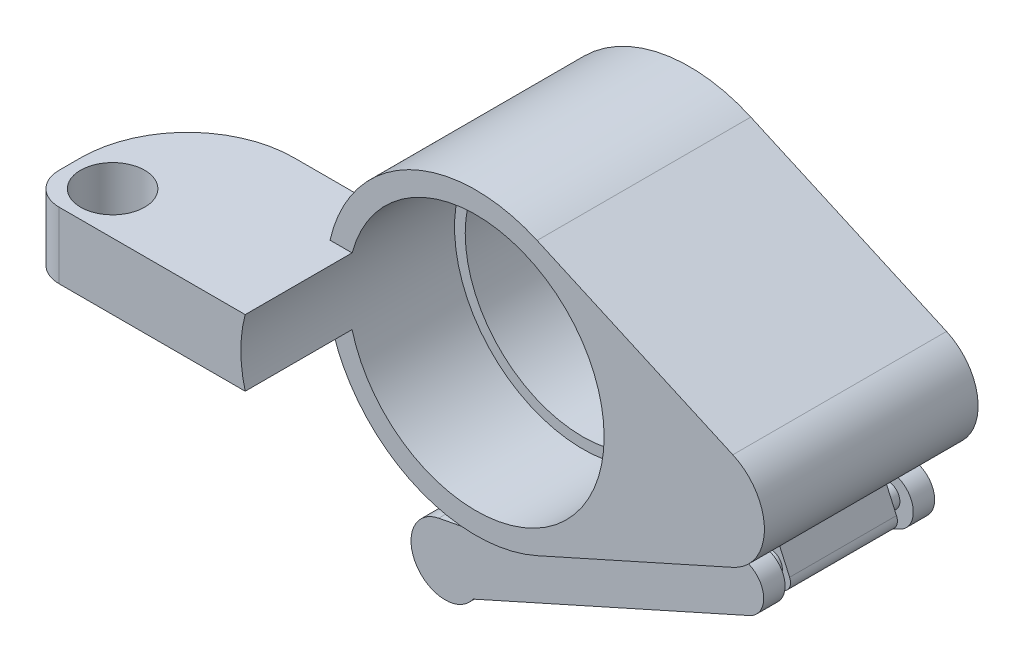
from build123d import *
from build123d.topology import SkipClean

# Parameters (mm, degrees)
ESQUISSE2_R             = 11
BOSS_EXTRU_1_DEPTH      = 20
ENL_V_START             = -10
ESQUISSE3_R             = 12
ESQUISSE3_R_2           = 11
ENL_V_MAT_EXTRU_1_DEPTH = 10
ESQUISSE4_W             = 3
ESQUISSE4_H             = 10
BOSS_EXTRU_2_DEPTH      = 4
ESQUISSE5_R             = 1.1
BOSS_EXTRU_3_DEPTH      = 1
ESQUISSE9_R             = 1.1
BOSS_EXTRU_5_DEPTH      = 2
BOSS_EXTRU_6_START      = -6
BOSS_EXTRU_6_DEPTH      = 8
CONG_1_R                = 1
CONG_2_R                = 1
BOSS_EXTRU_7_DEPTH      = 10
BOSS_EXTRU_8_DEPTH      = 10
BOSS_EXTRU_8_DEPTH_BACK = 5
CONG_3_R                = 10
CONG_4_R                = 3
ENL_V_MAT_EXTRU_2_REACH = 52.872
ESQUISSE11_R            = 3


with BuildPart() as part:
    # Esquisse2 → Boss.-Extru.1 (new body)
    with BuildSketch(Plane.XY):
        with BuildLine():
            Line((5.727272727, 12.774910845), (24.045454545, 4.562468159))
            ThreePointArc((24.045454545, 4.562468159), (27, 0), (24.045454545, -4.562468159))
            Line((24.045454545, -4.562468159), (5.727272727, -12.774910845))
            ThreePointArc((5.727272727, -12.774910845), (-14, 0), (5.727272727, 12.774910845))
        make_face()
        Circle(ESQUISSE2_R, mode=Mode.SUBTRACT)
    extrude(amount=BOSS_EXTRU_1_DEPTH)

    # Esquisse3 → Enlèv. mat.-Extru.1 (cut)
    with BuildSketch(Plane.XY.offset(20).offset(ENL_V_START)):
        Circle(ESQUISSE3_R)
        Circle(ESQUISSE3_R_2, mode=Mode.SUBTRACT)
    extrude(amount=ENL_V_MAT_EXTRU_1_DEPTH, mode=Mode.SUBTRACT)

    # Esquisse4 → Boss.-Extru.2 (add)
    with BuildSketch(Plane(origin=(5.727272727, -12.774910845, 0), x_dir=(0.9124936318129423, 0.4090909090909094, 0), z_dir=(0.40909090909090934, -0.9124936318129422, 0))):
        with Locations((17.5748599, 10)):
            Rectangle(ESQUISSE4_W, ESQUISSE4_H)
    extrude(amount=BOSS_EXTRU_2_DEPTH)

    # Esquisse5 → Boss.-Extru.3 (add)
    with BuildSketch(Plane.XY.offset(15)):
        with Locations(Location((22.582402284, -7.410182695, 0), (0, 0, 180))):
            Circle(ESQUISSE5_R)
    boss_extru_3 = extrude(amount=BOSS_EXTRU_3_DEPTH)

    # Symétrie1: Boss.-Extru.3 across plane
    add(boss_extru_3.mirror(Plane.XY.offset(10)))

    # Esquisse9 → Boss.-Extru.5 (add)
    # profile 1 of 2: a face of its own
    with BuildSketch(Plane.XY.offset(16)):
        with BuildLine():
            Line((21.323895477, -10.714144048), (23.605129557, -9.691416775))
            ThreePointArc((23.605129557, -9.691416775), (24.737785683, -6.717851558), (21.764220466, -5.585195432))
            Line((21.764220466, -5.585195432), (19.482986386, -6.607922705))
            Line((19.482986386, -6.607922705), (21.323895477, -10.714144048))
        make_face()
        with Locations(Location((22.582402284, -7.410182695, 0), (0, 0, 180))):
            Circle(ESQUISSE9_R, mode=Mode.SUBTRACT)
    # profile 2 of 2: a face of its own
    with BuildSketch(Plane.XY.offset(16)):
        with Locations(Location((22.582402284, -7.410182695, 0), (0, 0, 180))):
            Circle(ESQUISSE9_R)
    boss_extru_5 = extrude(amount=BOSS_EXTRU_5_DEPTH)

    # Esquisse9<4> → Boss.-Extru.6 (add)
    with BuildSketch(Plane.XY.offset(16).offset(BOSS_EXTRU_6_START)):
        with BuildLine():
            Line((-2.260153649, -21.287390546), (21.323895477, -10.714144048))
            Line((21.323895477, -10.714144048), (19.482986386, -6.607922705))
            Line((19.482986386, -6.607922705), (1.283727254, -14.767049742))
            ThreePointArc((1.283727254, -14.767049742), (0.201847525, -15.178661138), (-0.920349818, -15.462493505))
            Line((-0.920349818, -15.462493505), (-5.484659611, -16.339454049))
            ThreePointArc((-5.484659611, -16.339454049), (-7.55515779, -21.213423405), (-2.260153649, -21.287390546))
        make_face()
    boss_extru_6 = extrude(amount=BOSS_EXTRU_6_DEPTH)

    # Symétrie2: Boss.-Extru.5, Boss.-Extru.6 across plane
    add(boss_extru_5.mirror(Plane.XY.offset(10)))
    add(boss_extru_6.mirror(Plane.XY.offset(10)))

    # Congé1
    cong_1_edges = [part.edges().sort_by_distance(p)[0] for p in [
        (24.76932455, -8.621533595, 10),
    ]]
    fillet(cong_1_edges, radius=CONG_1_R)

    # Congé2
    cong_2_edges = [part.edges().sort_by_distance(p)[0] for p in [
        (22.031843655, -9.848806323, 10),
    ]]
    fillet(cong_2_edges, radius=CONG_2_R)

    # Esquisse10 → Boss.-Extru.7 (add)
    with SkipClean():  # the faces are left unmerged after this step: merging them gives an invalid solid
        with BuildSketch(Plane.XY.offset(20)):
            with BuildLine():
                Line((-13.651031791, -3.10633724), (-11.590973598, -3.10633724))
                ThreePointArc((-11.590973598, -3.10633724), (-12, 0), (-11.590973598, 3.10633724))
                Line((-11.590973598, 3.10633724), (-13.651031791, 3.10633724))
                ThreePointArc((-13.651031791, 3.10633724), (-14, 0), (-13.651031791, -3.10633724))
            make_face()
        extrude(amount=BOSS_EXTRU_7_DEPTH)

    # Esquisse10<3> → Boss.-Extru.8 (add, two sides: drawn at the far end of the back side and taken through both)
    with SkipClean():  # the faces are left unmerged after this step: merging them gives an invalid solid
        with BuildSketch(Plane.XY.offset(20).offset(-BOSS_EXTRU_8_DEPTH_BACK)):
            with BuildLine():
                Line((-32, -3.10633724), (-13.651031791, -3.10633724))
                ThreePointArc((-13.651031791, -3.10633724), (-13.912484413, -1.562938727), (-14, 0))
                ThreePointArc((-14, 0), (-13.912484413, 1.562938727), (-13.651031791, 3.10633724))
                Line((-13.651031791, 3.10633724), (-32, 3.10633724))
                Line((-32, 3.10633724), (-32, -3.10633724))
            make_face()
        extrude(amount=BOSS_EXTRU_8_DEPTH + BOSS_EXTRU_8_DEPTH_BACK)

    # Congé3
    cong_3_edges = [part.edges().sort_by_distance(p)[0] for p in [
        (-32, 0, 15),
    ]]
    fillet(cong_3_edges, radius=CONG_3_R)

    # Congé4
    cong_4_edges = [part.edges().sort_by_distance(p)[0] for p in [
        (-32, 0, 30),
    ]]
    fillet(cong_4_edges, radius=CONG_4_R)

    # Esquisse11 → Enlèv. mat.-Extru.2 (cut, up to next)
    with BuildSketch(Plane(origin=(0, 3.10633724, 0), x_dir=(1, 0, 0), z_dir=(0, 1, 0)), mode=Mode.PRIVATE) as enl_v_mat_extru_2_sk1:
        with Locations(Location((-28, -26, 0), (0, 0, 180))):
            Circle(ESQUISSE11_R)
    enl_v_mat_extru_2_tool1 = extrude(enl_v_mat_extru_2_sk1.sketch, amount=-ENL_V_MAT_EXTRU_2_REACH, mode=Mode.PRIVATE) & part.part
    add(enl_v_mat_extru_2_tool1.solids().sort_by_distance((-28, 3.106337, 26))[0], mode=Mode.SUBTRACT)


solid = part.part
